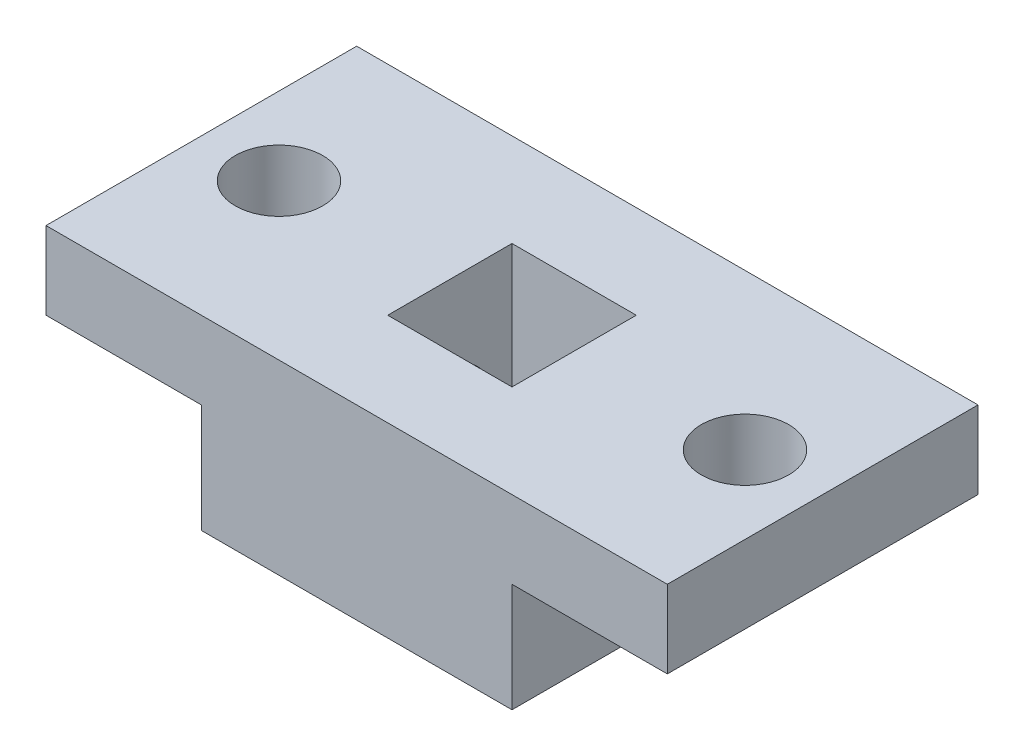
from build123d import *

# Parameters (mm, degrees)
BOSS_EXTRUDE1_DEPTH = 12.7
SKETCH3_W           = 5.08
SKETCH3_H           = 5.08
CUT_EXTRUDE1_DEPTH  = 6.35
SKETCH2_R           = 1.5875
CUT_EXTRUDE2_DEPTH  = 3.81
CUT_EXTRUDE3_REACH  = 20.502
SKETCH4_R           = 1.7859375


with BuildPart() as part:
    # Sketch1 → Boss-Extrude1 (new body)
    with BuildSketch(Plane.XY):
        Polygon((0, 0), (0, 7.62), (12.7, 7.62), (12.7, 4.445), (6.35, 4.445), (6.35, 0), align=None)
    extrude(amount=BOSS_EXTRUDE1_DEPTH)

    # Mirror1: part across plane


with BuildPart() as part_1:
    add(part.part)
    add(part.part.mirror(Plane(origin=(0, 0, 12.7), x_dir=(0, 0, 1), z_dir=(-1, 0, 0))))

    # Sketch3 → Cut-Extrude1 (cut)
    with BuildSketch(Plane(origin=(0, 7.62, 0), x_dir=(1, 0, 0), z_dir=(0, 1, 0))):
        with Locations((0, -6.35)):
            Rectangle(SKETCH3_W, SKETCH3_H)
    extrude(amount=-CUT_EXTRUDE1_DEPTH, mode=Mode.SUBTRACT)

    # Sketch2 → Cut-Extrude2 (cut)
    with BuildSketch(Plane.ZY.offset(6.35)):
        with Locations(Location((6.35, 2.8575, 0), (0, 0, 270))):
            Circle(SKETCH2_R)
    extrude(amount=-CUT_EXTRUDE2_DEPTH, mode=Mode.SUBTRACT)

    # Sketch4 → Cut-Extrude3 (cut, up to next)
    with BuildSketch(Plane.XZ.offset(-4.445), mode=Mode.PRIVATE) as cut_extrude3_sk1:
        with Locations((9.525, 6.35)):
            Circle(SKETCH4_R)
    cut_extrude3_tool1 = extrude(cut_extrude3_sk1.sketch, amount=-CUT_EXTRUDE3_REACH, mode=Mode.PRIVATE) & part_1.part
    # Sketch4 → Cut-Extrude3 (cut, up to next)
    with BuildSketch(Plane.XZ.offset(-4.445), mode=Mode.PRIVATE) as cut_extrude3_sk2:
        with Locations((-9.525, 6.35)):
            Circle(SKETCH4_R)
    cut_extrude3_tool2 = extrude(cut_extrude3_sk2.sketch, amount=-CUT_EXTRUDE3_REACH, mode=Mode.PRIVATE) & part_1.part
    add(cut_extrude3_tool1.solids().sort_by_distance((9.525, 4.445, 6.35))[0], mode=Mode.SUBTRACT)
    add(cut_extrude3_tool2.solids().sort_by_distance((-9.525, 4.445, 6.35))[0], mode=Mode.SUBTRACT)


solid = part_1.part
